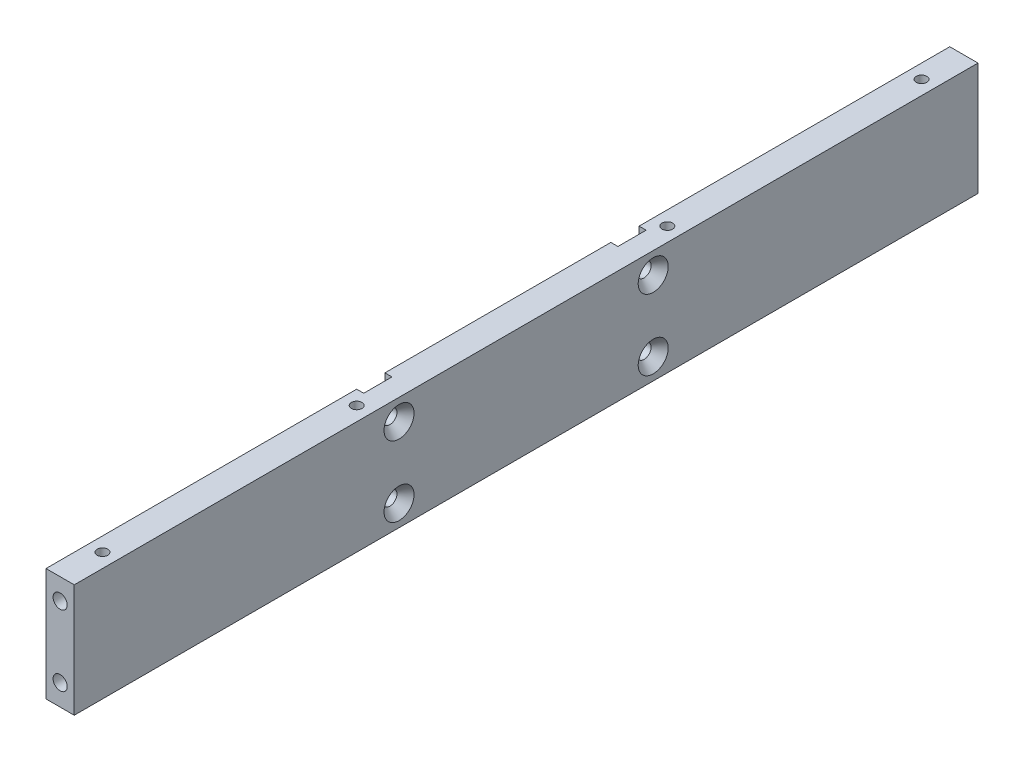
from build123d import *

# Parameters (mm, degrees)
SKETCH1_W                    = 406.4
SKETCH1_H                    = 50.8
EXTRUDE1_DEPTH               = 12.7
SKETCH2_W                    = 12.7
SKETCH2_H                    = 50.8
CUT_EXTRUDE1_DEPTH           = 3.175
SKETCH3_W                    = 44.45
SKETCH3_H                    = 31.75
SKETCH3_W_2                  = 76.2
CUT_EXTRUDE2_DEPTH           = 9.525
FILLET1_R                    = 6.35
SKETCH4_R                    = 2.38125
CUT_EXTRUDE3_DEPTH           = 15.875
SKETCH5_R                    = 3.175
CUT_EXTRUDE4_DEPTH           = 410.673437783
SKETCH6_R                    = 6.7437
CUT_EXTRUDE5_DEPTH           = 410.759551445
CUT_EXTRUDE5_DRAFT           = -41
CUT_EXTRUDE5_PROFILE_2_DEPTH = 410.759551445
CUT_EXTRUDE5_PROFILE_2_DRAFT = -41
CUT_EXTRUDE5_PROFILE_3_DEPTH = 410.759551445
CUT_EXTRUDE5_PROFILE_3_DRAFT = -41
CUT_EXTRUDE5_PROFILE_4_DEPTH = 410.759551445
CUT_EXTRUDE5_PROFILE_4_DRAFT = -41
SKETCH7_R                    = 3.175
CUT_EXTRUDE6_DEPTH           = 15.875
CUT_EXTRUDE7_START           = -15.875
SKETCH8_R                    = 3.175
CUT_EXTRUDE7_DEPTH           = 15.875


with BuildPart() as part:
    # Sketch1 → Extrude1 (new body)
    with BuildSketch(Plane(origin=(0, 0, 0), x_dir=(0, 0, -1), z_dir=(1, 0, 0))):
        with Locations((-203.2, 25.4)):
            Rectangle(SKETCH1_W, SKETCH1_H)
    extrude(amount=EXTRUDE1_DEPTH)

    # Sketch2 → Cut-Extrude1 (cut)
    with BuildSketch(Plane.ZY):
        with Locations((146.05, 25.4)):
            Rectangle(SKETCH2_W, SKETCH2_H)
        with Locations((260.35, 25.4)):
            Rectangle(SKETCH2_W, SKETCH2_H)
    extrude(amount=-CUT_EXTRUDE1_DEPTH, mode=Mode.SUBTRACT)

    # Sketch3 → Cut-Extrude2 (cut)
    with BuildSketch(Plane.ZY):
        with Locations((47.625, 25.4)):
            Rectangle(SKETCH3_W, SKETCH3_H)
        with Locations((104.775, 25.4)):
            Rectangle(SKETCH3_W, SKETCH3_H)
        with Locations((203.2, 25.4)):
            Rectangle(SKETCH3_W_2, SKETCH3_H)
        with Locations((301.625, 25.4)):
            Rectangle(SKETCH3_W, SKETCH3_H)
        with Locations((358.775, 25.4)):
            Rectangle(SKETCH3_W, SKETCH3_H)
    extrude(amount=-CUT_EXTRUDE2_DEPTH, mode=Mode.SUBTRACT)

    # Fillet1
    fillet1_edges = [part.edges().sort_by_distance(p)[0] for p in [
        (4.7625, 9.525, 25.4),
        (4.7625, 41.275, 25.4),
        (4.7625, 41.275, 69.85),
        (4.7625, 9.525, 69.85),
        (4.7625, 41.275, 127),
        (4.7625, 9.525, 127),
        (4.7625, 9.525, 82.55),
        (4.7625, 41.275, 82.55),
        (4.7625, 9.525, 165.1),
        (4.7625, 41.275, 165.1),
        (4.7625, 41.275, 241.3),
        (4.7625, 9.525, 241.3),
        (4.7625, 9.525, 279.4),
        (4.7625, 41.275, 279.4),
        (4.7625, 41.275, 323.85),
        (4.7625, 9.525, 323.85),
        (4.7625, 9.525, 336.55),
        (4.7625, 41.275, 336.55),
        (4.7625, 41.275, 381),
        (4.7625, 9.525, 381),
    ]]
    fillet(fillet1_edges, radius=FILLET1_R)

    # Sketch4 → Cut-Extrude3 (cut)
    with BuildSketch(Plane(origin=(0, 50.8, 0), x_dir=(-1, 0, 0), z_dir=(0, 1, 0))):
        with Locations(Location((-6.35, 19.05, 0), (0, 0, 90))):
            Circle(SKETCH4_R)
        with Locations(Location((-6.35, 133.35, 0), (0, 0, 90))):
            Circle(SKETCH4_R)
        with Locations(Location((-6.35, 273.05, 0), (0, 0, 90))):
            Circle(SKETCH4_R)
        with Locations(Location((-6.35, 387.35, 0), (0, 0, 90))):
            Circle(SKETCH4_R)
    cut_extrude3 = extrude(amount=-CUT_EXTRUDE3_DEPTH, mode=Mode.SUBTRACT)

    # Mirror1: Cut-Extrude3 across plane
    add(cut_extrude3.mirror(Plane.ZX.offset(25.4)), mode=Mode.SUBTRACT)

    # Sketch5 → Cut-Extrude4 (cut, through all)
    with BuildSketch(Plane.ZY.offset(-3.175)):
        with Locations((260.35, 41.275)):
            Circle(SKETCH5_R)
        with Locations((260.35, 9.525)):
            Circle(SKETCH5_R)
        with Locations((146.05, 41.275)):
            Circle(SKETCH5_R)
        with Locations((146.05, 9.525)):
            Circle(SKETCH5_R)
    extrude(amount=-CUT_EXTRUDE4_DEPTH, mode=Mode.SUBTRACT)


with BuildPart() as cut_extrude5_tool:
    # Sketch6 → Cut-Extrude5 (with draft: the straight prism first)
    with BuildSketch(Plane(origin=(12.7, 0, 0), x_dir=(0, 0, -1), z_dir=(1, 0, 0))):
        with Locations((-260.35, 41.275)):
            Circle(SKETCH6_R)
    extrude(amount=-CUT_EXTRUDE5_DEPTH)
    # Cut-Extrude5: the draft: its side faces are tilted about the plane it starts from
    cut_extrude5_sides = [cut_extrude5_tool.faces().sort_by_distance(p)[0] for p in [
        (-192.679775722, 41.275, 267.0937),
    ]]
    draft(cut_extrude5_sides, Plane(origin=(12.7, 0, 0), x_dir=(0, 0, -1), z_dir=(1, 0, 0)), CUT_EXTRUDE5_DRAFT)


with BuildPart() as part_1:
    add(part.part)

    # Cut-Extrude5: cut by cut_extrude5_tool
    add(cut_extrude5_tool.part, mode=Mode.SUBTRACT)


with BuildPart() as cut_extrude5_profile_2_tool:
    # Sketch6 → Cut-Extrude5 profile 2 (with draft: the straight prism first)
    with BuildSketch(Plane(origin=(12.7, 0, 0), x_dir=(0, 0, -1), z_dir=(1, 0, 0))):
        with Locations((-260.35, 9.525)):
            Circle(SKETCH6_R)
    extrude(amount=-CUT_EXTRUDE5_PROFILE_2_DEPTH)
    # Cut-Extrude5 profile 2: the draft: its side faces are tilted about the plane it starts from
    cut_extrude5_profile_2_sides = [cut_extrude5_profile_2_tool.faces().sort_by_distance(p)[0] for p in [
        (-192.679775722, 9.525, 267.0937),
    ]]
    draft(cut_extrude5_profile_2_sides, Plane(origin=(12.7, 0, 0), x_dir=(0, 0, -1), z_dir=(1, 0, 0)), CUT_EXTRUDE5_PROFILE_2_DRAFT)


with BuildPart() as part_2:
    add(part_1.part)

    # Cut-Extrude5 profile 2: cut by cut_extrude5_profile_2_tool
    add(cut_extrude5_profile_2_tool.part, mode=Mode.SUBTRACT)


with BuildPart() as cut_extrude5_profile_3_tool:
    # Sketch6 → Cut-Extrude5 profile 3 (with draft: the straight prism first)
    with BuildSketch(Plane(origin=(12.7, 0, 0), x_dir=(0, 0, -1), z_dir=(1, 0, 0))):
        with Locations((-146.05, 9.525)):
            Circle(SKETCH6_R)
    extrude(amount=-CUT_EXTRUDE5_PROFILE_3_DEPTH)
    # Cut-Extrude5 profile 3: the draft: its side faces are tilted about the plane it starts from
    cut_extrude5_profile_3_sides = [cut_extrude5_profile_3_tool.faces().sort_by_distance(p)[0] for p in [
        (-192.679775722, 9.525, 152.7937),
    ]]
    draft(cut_extrude5_profile_3_sides, Plane(origin=(12.7, 0, 0), x_dir=(0, 0, -1), z_dir=(1, 0, 0)), CUT_EXTRUDE5_PROFILE_3_DRAFT)


with BuildPart() as part_3:
    add(part_2.part)

    # Cut-Extrude5 profile 3: cut by cut_extrude5_profile_3_tool
    add(cut_extrude5_profile_3_tool.part, mode=Mode.SUBTRACT)


with BuildPart() as cut_extrude5_profile_4_tool:
    # Sketch6 → Cut-Extrude5 profile 4 (with draft: the straight prism first)
    with BuildSketch(Plane(origin=(12.7, 0, 0), x_dir=(0, 0, -1), z_dir=(1, 0, 0))):
        with Locations((-146.05, 41.275)):
            Circle(SKETCH6_R)
    extrude(amount=-CUT_EXTRUDE5_PROFILE_4_DEPTH)
    # Cut-Extrude5 profile 4: the draft: its side faces are tilted about the plane it starts from
    cut_extrude5_profile_4_sides = [cut_extrude5_profile_4_tool.faces().sort_by_distance(p)[0] for p in [
        (-192.679775722, 41.275, 152.7937),
    ]]
    draft(cut_extrude5_profile_4_sides, Plane(origin=(12.7, 0, 0), x_dir=(0, 0, -1), z_dir=(1, 0, 0)), CUT_EXTRUDE5_PROFILE_4_DRAFT)


with BuildPart() as part_4:
    add(part_3.part)

    # Cut-Extrude5 profile 4: cut by cut_extrude5_profile_4_tool
    add(cut_extrude5_profile_4_tool.part, mode=Mode.SUBTRACT)

    # Sketch7 → Cut-Extrude6 (cut)
    with BuildSketch(Plane(origin=(0, 0, 0), x_dir=(-1, 0, 0), z_dir=(0, 0, -1))):
        with Locations((-6.35, 41.275)):
            Circle(SKETCH7_R)
        with Locations((-6.35, 9.525)):
            Circle(SKETCH7_R)
    extrude(amount=-CUT_EXTRUDE6_DEPTH, mode=Mode.SUBTRACT)

    # Sketch8 → Cut-Extrude7 (cut)
    with BuildSketch(Plane.XY.offset(406.4).offset(CUT_EXTRUDE7_START)):
        with Locations(Location((6.35, 41.275, 0), (0, 0, 180))):
            Circle(SKETCH8_R)
        with Locations(Location((6.35, 9.525, 0), (0, 0, 180))):
            Circle(SKETCH8_R)
    extrude(amount=CUT_EXTRUDE7_DEPTH, mode=Mode.SUBTRACT)


solid = part_4.part
